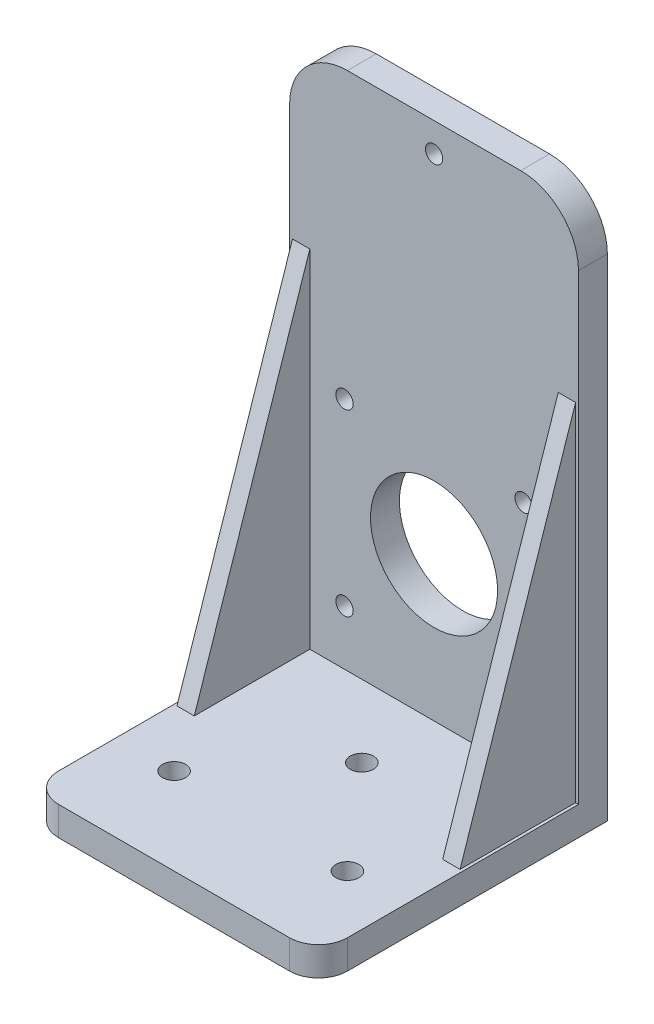
from build123d import *

# Parameters (mm, degrees)
ESQUISSE1_R             = 11
BOSS_EXTRU_2_DEPTH      = 5
ESQUISSE3_W             = 50
ESQUISSE3_H             = 5
BOSS_EXTRU_4_DEPTH      = 5
ESQUISSE2_W             = 50
ESQUISSE2_H             = 5
BOSS_EXTRU_3_DEPTH      = 45
ESQUISSE4_R             = 1.5
ENL_V_MAT_EXTRU_1_DEPTH = 60.581876439
CONG_1_R                = 5
ESQUISSE5_R             = 1.5
ESQUISSE5_R_2           = 11
BOSS_EXTRU_5_DEPTH      = 5
BOSS_EXTRU_6_START      = -0.5
BOSS_EXTRU_6_DEPTH      = 3
ESQUISSE9_R             = 2
ENL_V_MAT_EXTRU_3_DEPTH = 106.948100502


with BuildPart() as part:
    # Esquisse1 → Boss.-Extru.2 (new body)
    with BuildSketch(Plane.XY):
        with BuildLine():
            Line((-20, 25), (20, 25))
            ThreePointArc((20, 25), (23.535533906, 23.535533906), (25, 20))
            Line((25, 20), (25, -25))
            Line((25, -25), (-25, -25))
            Line((-25, -25), (-25, 20))
            ThreePointArc((-25, 20), (-23.535533906, 23.535533906), (-20, 25))
        make_face()
        Circle(ESQUISSE1_R, mode=Mode.SUBTRACT)
    extrude(amount=BOSS_EXTRU_2_DEPTH)

    # Esquisse3 → Boss.-Extru.4 (add)
    with BuildSketch(Plane.XZ.offset(25)):
        with Locations((0, 2.5)):
            Rectangle(ESQUISSE3_W, ESQUISSE3_H)
    extrude(amount=BOSS_EXTRU_4_DEPTH)

    # Esquisse2 → Boss.-Extru.3 (add)
    with BuildSketch(Plane.XY.offset(5)):
        with Locations((0, -27.5)):
            Rectangle(ESQUISSE2_W, ESQUISSE2_H)
    extrude(amount=BOSS_EXTRU_3_DEPTH)

    # Esquisse4 → Enlèv. mat.-Extru.1 (cut, through all)
    with BuildSketch(Plane.XY.offset(5)):
        with Locations((-15.5, 15.5)):
            Circle(ESQUISSE4_R)
        with Locations((15.5, 15.5)):
            Circle(ESQUISSE4_R)
        with Locations((15.5, -15.5)):
            Circle(ESQUISSE4_R)
        with Locations((-15.5, -15.5)):
            Circle(ESQUISSE4_R)
    extrude(amount=-ENL_V_MAT_EXTRU_1_DEPTH, mode=Mode.SUBTRACT)

    # Congé1
    cong_1_edges = [part.edges().sort_by_distance(p)[0] for p in [
        (25, -27.5, 50),
        (-25, -27.5, 50),
    ]]
    fillet(cong_1_edges, radius=CONG_1_R)

    # Esquisse5 → Boss.-Extru.5 (add)
    # profile 1 of 3: a face of its own
    with BuildSketch(Plane(origin=(0, 0, 0), x_dir=(-1, 0, 0), z_dir=(0, 0, -1))):
        with BuildLine():
            ThreePointArc((-20, 25), (-23.535533906, 23.535533906), (-25, 20))
            Line((-25, 20), (-25, -30))
            Line((-25, -30), (25, -30))
            Line((25, -30), (25, 20))
            ThreePointArc((25, 20), (23.535533906, 23.535533906), (20, 25))
            Line((20, 25), (-20, 25))
        make_face()
        with Locations(Location((-15.5, -15.5, 0), (0, 0, 180))):
            Circle(ESQUISSE5_R, mode=Mode.SUBTRACT)
        with Locations(Location((-15.5, 15.5, 0), (0, 0, 180))):
            Circle(ESQUISSE5_R, mode=Mode.SUBTRACT)
        with Locations(Location((0, 0, 0), (0, 0, 180))):
            Circle(ESQUISSE5_R_2, mode=Mode.SUBTRACT)
        with Locations(Location((15.5, -15.5, 0), (0, 0, 180))):
            Circle(ESQUISSE5_R, mode=Mode.SUBTRACT)
        with Locations(Location((15.5, 15.5, 0), (0, 0, 180))):
            Circle(ESQUISSE5_R, mode=Mode.SUBTRACT)
    # profile 2 of 3: a face of its own
    with BuildSketch(Plane(origin=(0, 0, 0), x_dir=(-1, 0, 0), z_dir=(0, 0, -1))):
        with BuildLine():
            Line((-25, 55), (-25, 20))
            ThreePointArc((-25, 20), (-23.535533906, 23.535533906), (-20, 25))
            Line((-20, 25), (20, 25))
            ThreePointArc((20, 25), (23.535533906, 23.535533906), (25, 20))
            Line((25, 20), (25, 55))
            ThreePointArc((25, 55), (22.071067812, 62.071067812), (15, 65))
            Line((15, 65), (-15, 65))
            ThreePointArc((-15, 65), (-22.071067812, 62.071067812), (-25, 55))
        make_face()
        with Locations((0, 60)):
            Circle(ESQUISSE5_R, mode=Mode.SUBTRACT)
    # profile 3 of 3: a face of its own
    with BuildSketch(Plane(origin=(0, 0, 0), x_dir=(-1, 0, 0), z_dir=(0, 0, -1))):
        with BuildLine():
            ThreePointArc((-20, 25), (-23.535533906, 23.535533906), (-25, 20))
            Line((-25, 20), (-25, -30))
            Line((-25, -30), (25, -30))
            Line((25, -30), (25, 20))
            ThreePointArc((25, 20), (23.535533906, 23.535533906), (20, 25))
            Line((20, 25), (-20, 25))
        make_face()
        with Locations(Location((-15.5, -15.5, 0), (0, 0, 180))):
            Circle(ESQUISSE5_R, mode=Mode.SUBTRACT)
        with Locations(Location((-15.5, 15.5, 0), (0, 0, 180))):
            Circle(ESQUISSE5_R, mode=Mode.SUBTRACT)
        with Locations(Location((0, 0, 0), (0, 0, 180))):
            Circle(ESQUISSE5_R_2, mode=Mode.SUBTRACT)
        with Locations(Location((15.5, -15.5, 0), (0, 0, 180))):
            Circle(ESQUISSE5_R, mode=Mode.SUBTRACT)
        with Locations(Location((15.5, 15.5, 0), (0, 0, 180))):
            Circle(ESQUISSE5_R, mode=Mode.SUBTRACT)
    extrude(amount=-BOSS_EXTRU_5_DEPTH)

    # Esquisse7 → Boss.-Extru.6 (add)
    with BuildSketch(Plane.ZY.offset(25).offset(BOSS_EXTRU_6_START)):
        Polygon((25, -25), (5, 35), (5, -25), align=None)
    boss_extru_6 = extrude(amount=-BOSS_EXTRU_6_DEPTH)

    # Symétrie1: Boss.-Extru.6 across plane
    add(boss_extru_6.mirror(Plane(origin=(0, 0, 0), x_dir=(0, 0, 1), z_dir=(1, 0, 0))))

    # Esquisse9 → Enlèv. mat.-Extru.3 (cut, through all)
    with BuildSketch(Plane(origin=(0, -25, 0), x_dir=(1, 0, 0), z_dir=(0, 1, 0))):
        with Locations(Location((-15, -35, 0), (0, 0, 270))):
            Circle(ESQUISSE9_R)
        with Locations(Location((15, -35, 0), (0, 0, 90))):
            Circle(ESQUISSE9_R)
        with Locations(Location((0, -17.5, 0), (0, 0, 270))):
            Circle(ESQUISSE9_R)
    extrude(amount=-ENL_V_MAT_EXTRU_3_DEPTH, mode=Mode.SUBTRACT)


solid = part.part
